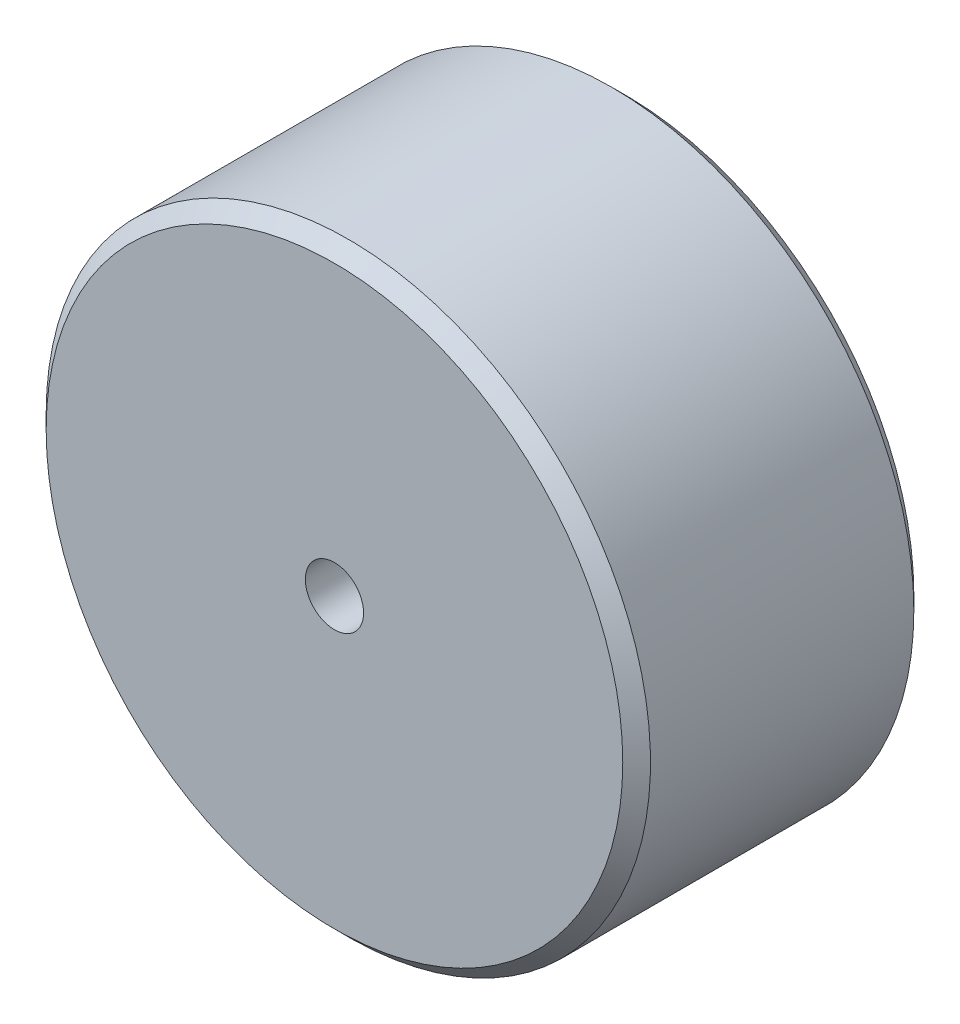
from build123d import *

# Parameters (mm, degrees)
SKETCH1_R           = 21.8
BOSS_EXTRUDE1_DEPTH = 21
CHAMFER1_SIZE       = 1
SKETCH2_R           = 2.1
CUT_EXTRUDE1_DEPTH  = 5.8


with BuildPart() as part:
    # Sketch1 → Boss-Extrude1 (new body)
    with BuildSketch(Plane.XY):
        with Locations(Location((0, 0, 0), (0, 0, 180))):
            Circle(SKETCH1_R)
    extrude(amount=BOSS_EXTRUDE1_DEPTH)

    # Chamfer1
    chamfer1_edges = [part.edges().sort_by_distance(p)[0] for p in [
        (21.8, 0, 0),
        (21.8, 0, 21),
    ]]
    chamfer(chamfer1_edges, length=CHAMFER1_SIZE)

    # Sketch2 → Cut-Extrude1 (cut)
    with BuildSketch(Plane.XY.offset(21)):
        Circle(SKETCH2_R)
    extrude(amount=-CUT_EXTRUDE1_DEPTH, mode=Mode.SUBTRACT)


solid = part.part
